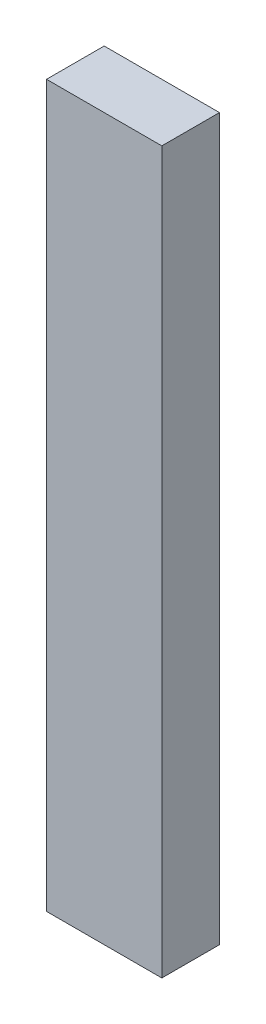
from build123d import *

# Parameters (mm, degrees)
SKETCH_1_W      = 40
SKETCH_1_H      = 20
EXTRUDE_1_DEPTH = 250


with BuildPart() as part:
    # Эскиз1 → Бобышка-Вытянуть1 (new body)
    with BuildSketch(Plane(origin=(0, 0, 0), x_dir=(1, 0, 0), z_dir=(0, 1, 0))):
        with Locations((20, 10)):
            Rectangle(SKETCH_1_W, SKETCH_1_H)
    extrude(amount=EXTRUDE_1_DEPTH)


solid = part.part
